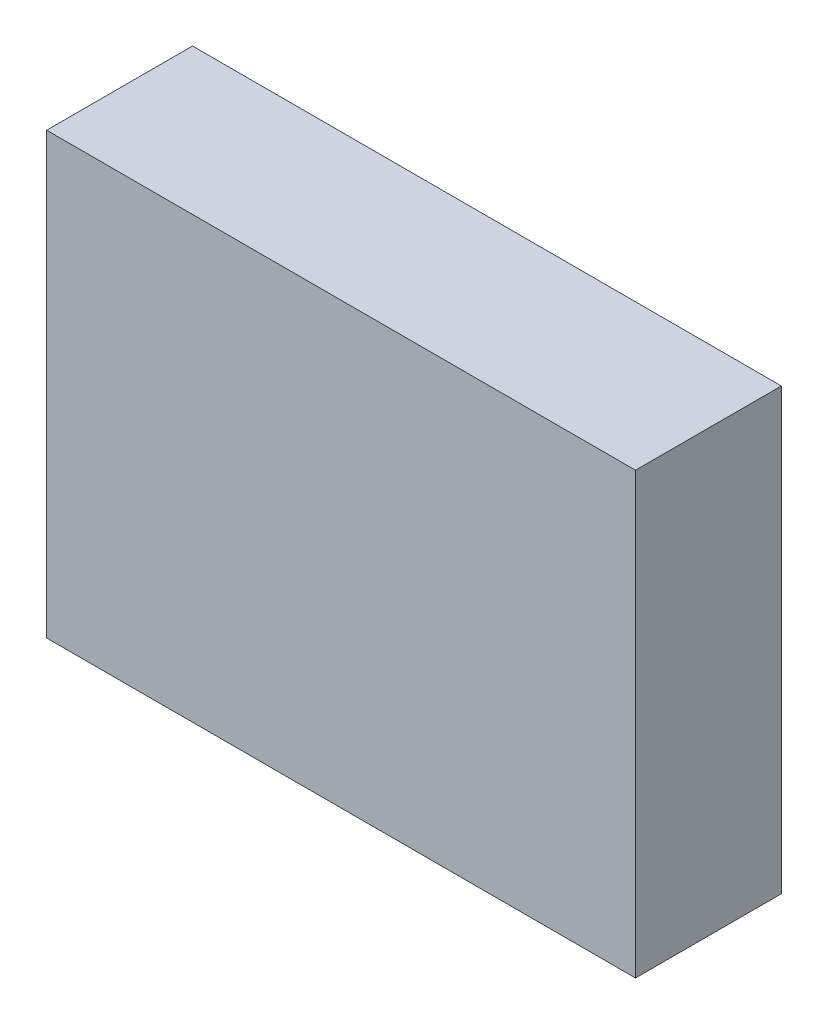
from build123d import *

# Parameters (mm, degrees)
ESQUISSE1_W        = 60.555927554
ESQUISSE1_H        = 45.224023668
BOSS_EXTRU_1_DEPTH = 15


with BuildPart() as part:
    # Esquisse1 → Boss.-Extru.1 (new body)
    with BuildSketch(Plane.XY):
        Rectangle(ESQUISSE1_W, ESQUISSE1_H)
    extrude(amount=BOSS_EXTRU_1_DEPTH)


solid = part.part
